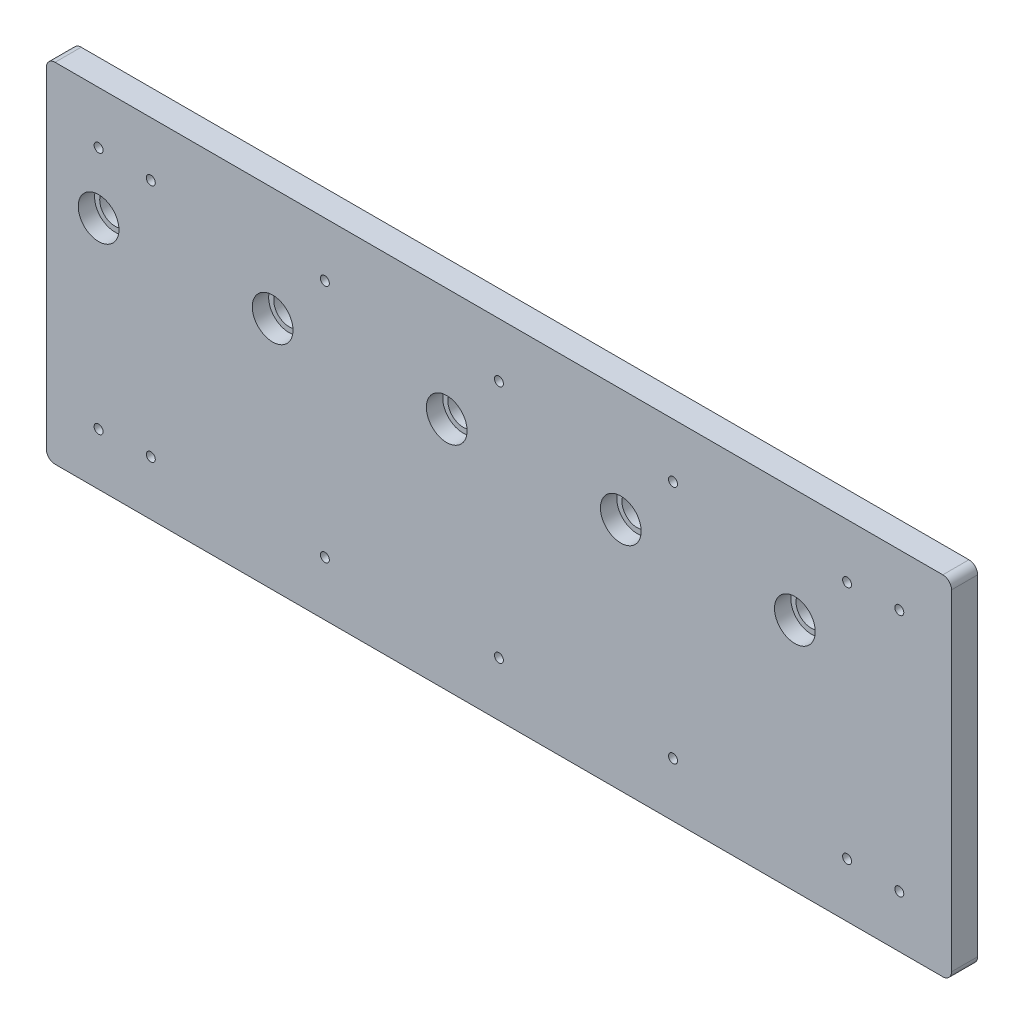
from build123d import *

# Parameters (mm, degrees)
SKETCH2_W               = 660.4
SKETCH2_H               = 254
BOSS_EXTRUDE1_DEPTH     = 19.05
F_1_4_CLEARANCE_HOLE1_D = 6.5278
FILLET1_R               = 6.35
F_1_4_CLEARANCE_HOLE2_D = 6.5278
SKETCH10_R              = 11.1125
CUT_EXTRUDE1_DEPTH      = 355.293582358
SKETCH12_R              = 14.859
CUT_EXTRUDE2_DEPTH      = 11.938


with BuildPart() as part:
    # Sketch2 → Boss-Extrude1 (new body)
    with BuildSketch(Plane.XY):
        Rectangle(SKETCH2_W, SKETCH2_H)
    extrude(amount=BOSS_EXTRUDE1_DEPTH)

    # 1/4 Clearance Hole1 (through all)
    with Locations(Plane.XY.offset(19.05)):
        with Locations((-254, -87.376), (-254, 87.376), (-127, 87.376), (0, 87.376), (127, 87.376), (254, 87.376), (-127, -87.376), (0, -87.376), (127, -87.376), (254, -87.376)):
            Hole(F_1_4_CLEARANCE_HOLE1_D / 2)

    # Fillet1
    fillet1_edges = [part.edges().sort_by_distance(p)[0] for p in [
        (330.2, -127, 9.525),
        (-330.2, -127, 9.525),
        (-330.2, 127, 9.525),
        (330.2, 127, 9.525),
    ]]
    fillet(fillet1_edges, radius=FILLET1_R)

    # 1/4 Clearance Hole2 (through all)
    with Locations(Plane.XY.offset(19.05)):
        with Locations((-292.1, 88.9), (292.1, -88.9), (-292.1, -88.9), (292.1, 88.9)):
            Hole(F_1_4_CLEARANCE_HOLE2_D / 2)

    # Sketch10 → Cut-Extrude1 (cut, through all)
    with BuildSketch(Plane(origin=(0, 0, 0), x_dir=(-1, 0, 0), z_dir=(0, 0, -1))):
        with Locations((-215.9, 44.45)):
            Circle(SKETCH10_R)
        with Locations((-88.9, 44.45)):
            Circle(SKETCH10_R)
        with Locations((38.1, 44.45)):
            Circle(SKETCH10_R)
        with Locations((165.1, 44.45)):
            Circle(SKETCH10_R)
        with Locations((292.1, 44.45)):
            Circle(SKETCH10_R)
    extrude(amount=-CUT_EXTRUDE1_DEPTH, mode=Mode.SUBTRACT)

    # Sketch12 → Cut-Extrude2 (cut)
    with BuildSketch(Plane.XY.offset(19.05)):
        with Locations((-292.1, 44.45)):
            Circle(SKETCH12_R)
        with Locations((-165.1, 44.45)):
            Circle(SKETCH12_R)
        with Locations((-38.1, 44.45)):
            Circle(SKETCH12_R)
        with Locations((88.9, 44.45)):
            Circle(SKETCH12_R)
        with Locations((215.9, 44.45)):
            Circle(SKETCH12_R)
    extrude(amount=-CUT_EXTRUDE2_DEPTH, mode=Mode.SUBTRACT)


solid = part.part
